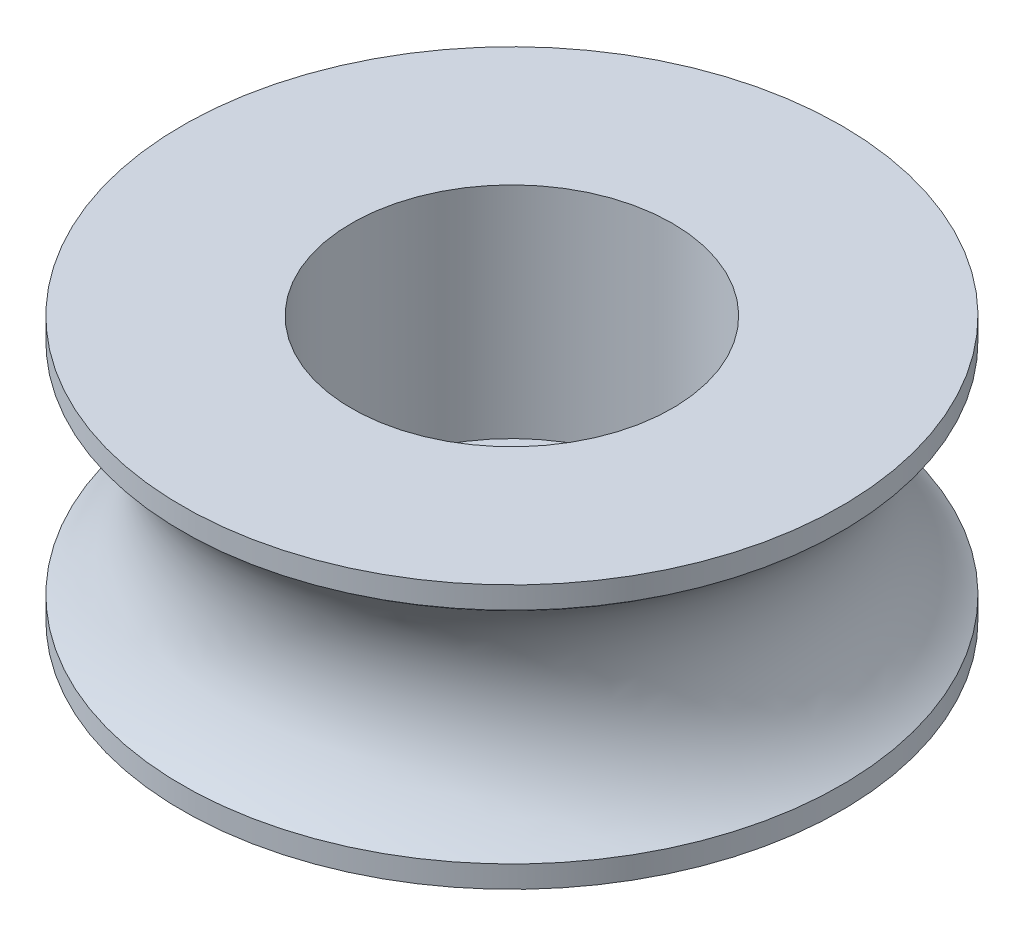
from build123d import *


with BuildPart() as part:
    # Sketch1 → Revolve1 (revolve)
    with BuildSketch(Plane.XY, mode=Mode.PRIVATE) as revolve1_sk:
        with BuildLine():
            Line((-2.5, 0), (-7.5, 0))
            Line((-7.5, 0), (-7.5, 0.5))
            ThreePointArc((-7.5, 0.5), (-6.158312395, 3), (-7.5, 5.5))
            Line((-7.5, 5.5), (-7.5, 6))
            Line((-7.5, 6), (-3.65, 6))
            Line((-3.65, 6), (-3.65, 1))
            Line((-3.65, 1), (-2.5, 1))
            Line((-2.5, 1), (-2.5, 0))
        make_face()
    revolve(revolve1_sk.sketch.rotate(Axis((0, -6.629530881, 0), (0, 1, 0)), 270), axis=Axis((0, -6.629530881, 0), (0, 1, 0)))


solid = part.part
